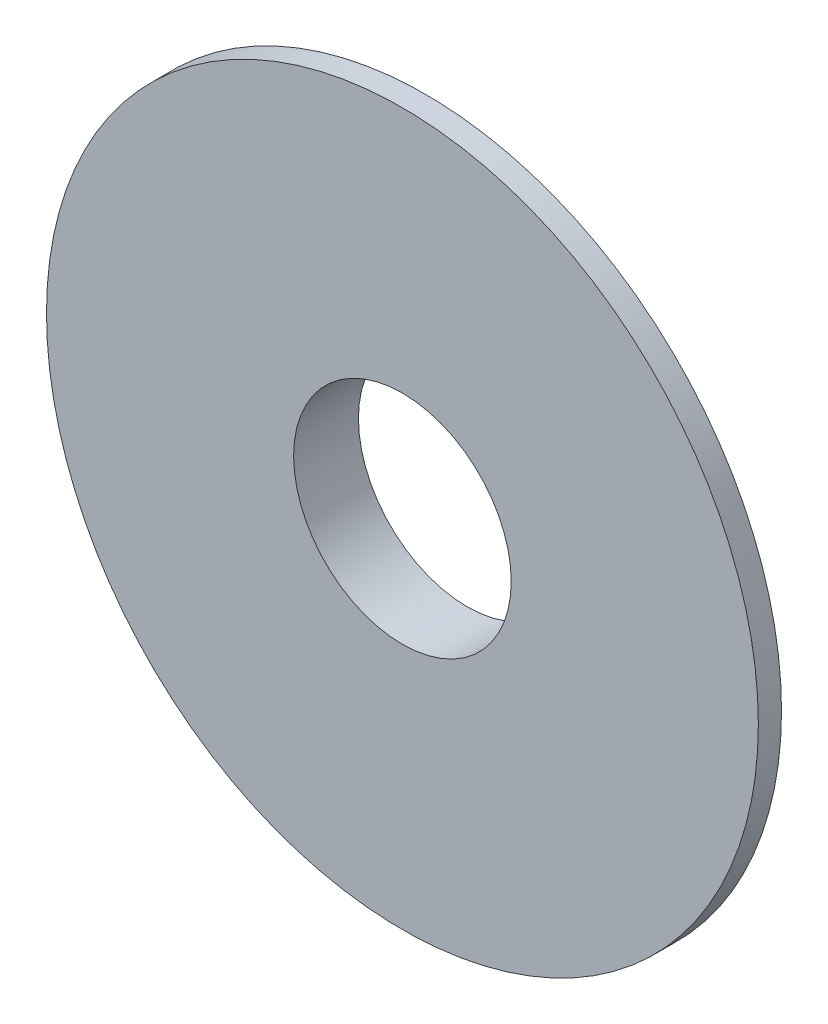
from build123d import *

# Parameters (mm, degrees)
COVER_WEB_START    = 35
SKETCH_1_R         = 76.876923077
SKETCH_1_R_2       = 23.5
COVER_WEB_DEPTH    = 5
BEARING_BOSS_START = 26
SKETCH_2_R         = 27.5
SKETCH_2_R_2       = 23.5
BEARING_BOSS_DEPTH = 14


with BuildPart() as part:
    # Эскиз1 → Cover_web (new body)
    with BuildSketch(Plane.XY.offset(COVER_WEB_START)):
        Circle(SKETCH_1_R)
        Circle(SKETCH_1_R_2, mode=Mode.SUBTRACT)
    extrude(amount=COVER_WEB_DEPTH)

    # Эскиз2 → Bearing_boss (add)
    with BuildSketch(Plane.XY.offset(BEARING_BOSS_START)):
        Circle(SKETCH_2_R)
        Circle(SKETCH_2_R_2, mode=Mode.SUBTRACT)
    extrude(amount=BEARING_BOSS_DEPTH)


solid = part.part
